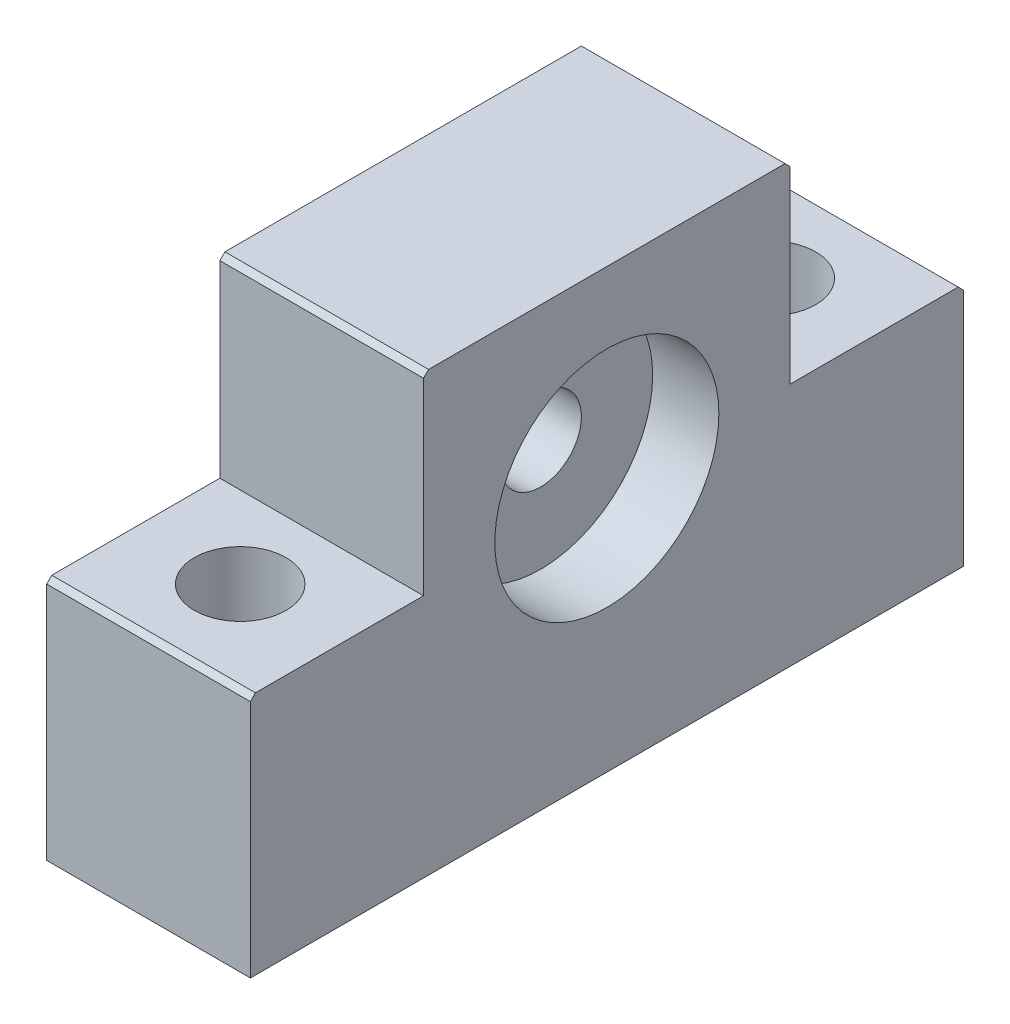
from build123d import *

# Parameters (mm, degrees)
BOSS_EXTRUDE1_DEPTH = 20
DIAMETERHOLE1_D     = 9


with BuildPart() as part:
    # Sketch1 → Boss-Extrude1 (new body)
    with BuildSketch(Plane(origin=(0, 0, 0), x_dir=(0, 0, -1), z_dir=(1, 0, 0))):
        Polygon((-18, 42.5), (-18, 24), (-34.5, 24), (-35, 23.5), (-35, 0), (35, 0), (35, 23.5), (34.5, 24), (18, 24), (18, 42.5), (17.5, 43), (-17.5, 43), align=None)
    extrude(amount=BOSS_EXTRUDE1_DEPTH)

    # Sketch4 → Cut-Revolve1 (revolve, cut)
    with BuildSketch(Plane.XY):
        Polygon((0, 36), (6.5, 36), (6.5, 29), (13.5, 29), (13.5, 36), (20, 36), (20, 25), (0, 25), align=None)
    revolve(axis=Axis((20, 25, 0), (-1, 0, 0)), mode=Mode.SUBTRACT)

    # DiameterHole1 (through all)
    with Locations(Plane(origin=(0, 24, 0), x_dir=(1, 0, 0), z_dir=(0, 1, 0))):
        with Locations((10, -26), (10, 26)):
            Hole(DIAMETERHOLE1_D / 2)


solid = part.part
